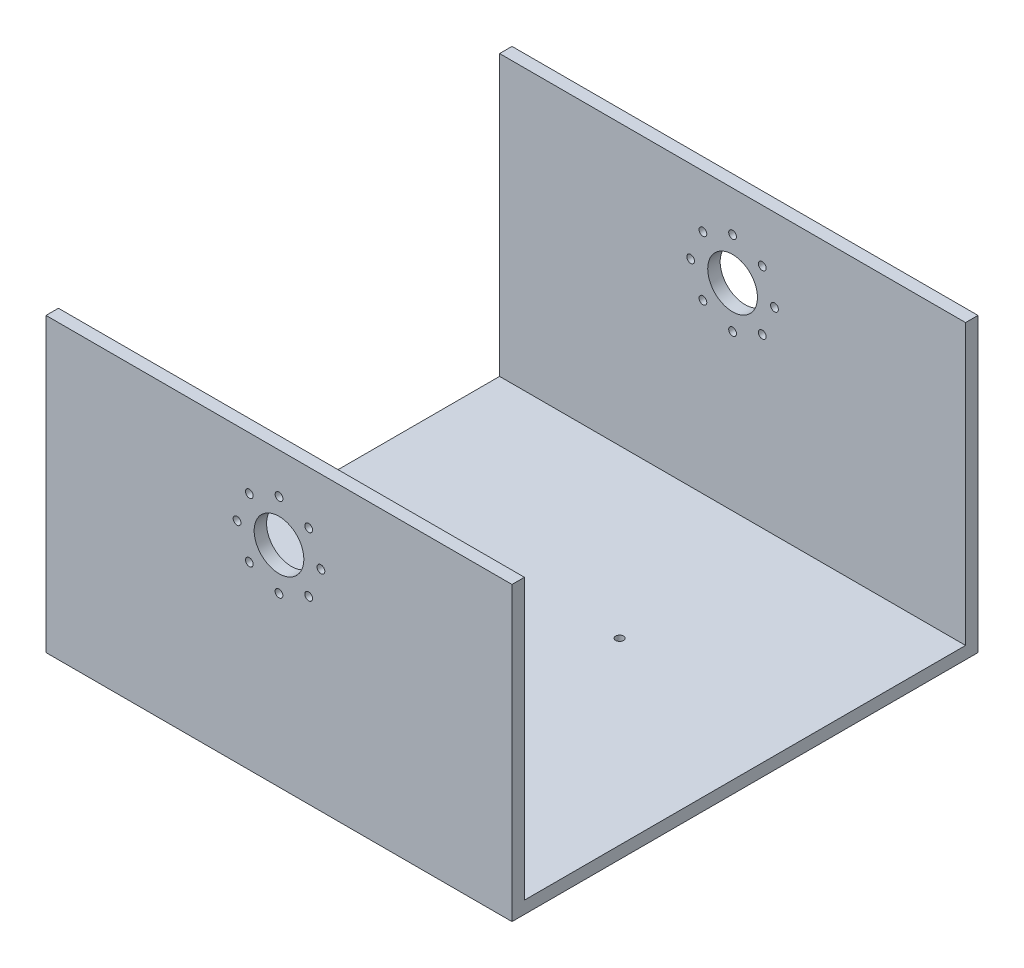
from build123d import *

# Parameters (mm, degrees)
SKETCH5_W           = 300
SKETCH5_H           = 300
BOSS_EXTRUDE4_DEPTH = 8
SKETCH6_R           = 5
SKETCH6_R_2         = 2.5
CUT_EXTRUDE2_DEPTH  = 16
SKETCH7_W           = 300
SKETCH7_H           = 8
BOSS_EXTRUDE5_DEPTH = 180
SKETCH9_R           = 16
CUT_EXTRUDE3_DEPTH  = 350
SKETCH11_R          = 2.5
CUT_EXTRUDE4_DEPTH  = 310


with BuildPart() as part:
    # Sketch5 → Boss-Extrude4 (new body)
    with BuildSketch(Plane(origin=(0, 0, 0), x_dir=(1, 0, 0), z_dir=(0, 1, 0))):
        Rectangle(SKETCH5_W, SKETCH5_H)
    extrude(amount=BOSS_EXTRUDE4_DEPTH)

    # Sketch6 → Cut-Extrude2 (cut)
    with BuildSketch(Plane(origin=(0, 8, 0), x_dir=(1, 0, 0), z_dir=(0, 1, 0))):
        with Locations(Location((0, 0, 0), (0, 0, 270))):
            Circle(SKETCH6_R)
        with Locations(Location((-34.62667873, 34.62667873, 0), (0, 0, 270))):
            Circle(SKETCH6_R_2)
        with Locations(Location((34.62667873, 34.62667873, 0), (0, 0, 270))):
            Circle(SKETCH6_R_2)
        with Locations(Location((34.62667873, -34.62667873, 0), (0, 0, 270))):
            Circle(SKETCH6_R_2)
        with Locations(Location((-34.62667873, -34.62667873, 0), (0, 0, 270))):
            Circle(SKETCH6_R_2)
    extrude(amount=-CUT_EXTRUDE2_DEPTH, mode=Mode.SUBTRACT)

    # Sketch7 → Boss-Extrude5 (add)
    with BuildSketch(Plane(origin=(0, 8, 0), x_dir=(1, 0, 0), z_dir=(0, 1, 0))):
        with Locations((0, 146)):
            Rectangle(SKETCH7_W, SKETCH7_H)
        with Locations((0, -146)):
            Rectangle(SKETCH7_W, SKETCH7_H)
    extrude(amount=BOSS_EXTRUDE5_DEPTH)

    # Sketch9 → Cut-Extrude3 (cut)
    with BuildSketch(Plane.XY.offset(150)):
        with Locations((0, 135)):
            Circle(SKETCH9_R)
    extrude(amount=-CUT_EXTRUDE3_DEPTH, mode=Mode.SUBTRACT)

    # Sketch11 → Cut-Extrude4 (cut)
    with BuildSketch(Plane.XY.offset(150)):
        with Locations((0, 162)):
            Circle(SKETCH11_R)
        with Locations((19.091883092, 154.091883092)):
            Circle(SKETCH11_R)
        with Locations((27, 135)):
            Circle(SKETCH11_R)
        with Locations((19.091883092, 115.908116908)):
            Circle(SKETCH11_R)
        with Locations((0, 108)):
            Circle(SKETCH11_R)
        with Locations((-19.091883092, 115.908116908)):
            Circle(SKETCH11_R)
        with Locations((-27, 135)):
            Circle(SKETCH11_R)
        with Locations((-19.091883092, 154.091883092)):
            Circle(SKETCH11_R)
    extrude(amount=-CUT_EXTRUDE4_DEPTH, mode=Mode.SUBTRACT)


solid = part.part
